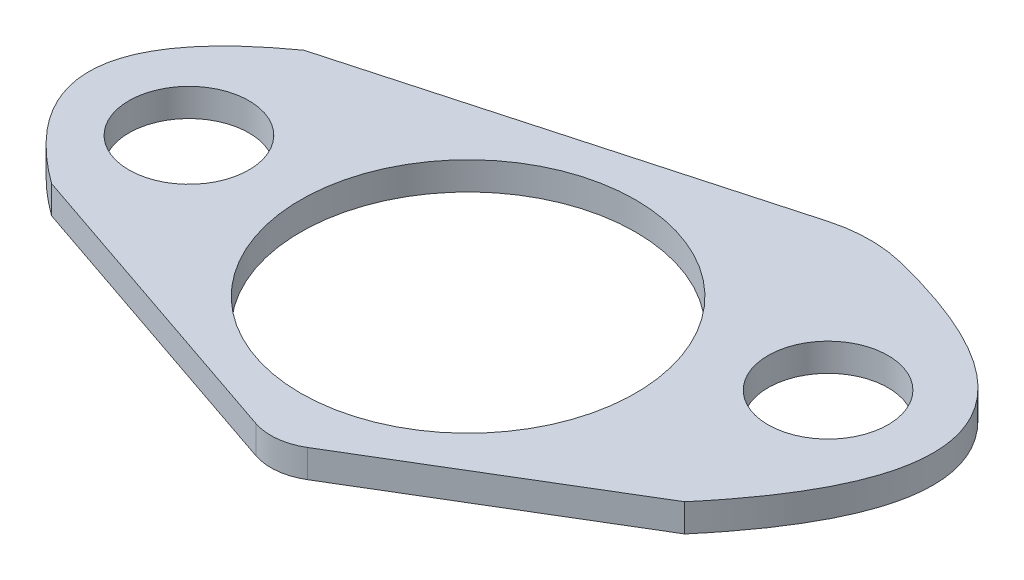
from build123d import *

# Parameters (mm, degrees)
BOSS_EXTRUDE2_DEPTH = 1
SKETCH3_R           = 6
SKETCH3_R_2         = 2.15
CUT_EXTRUDE1_DEPTH  = 1
FILLET1_R           = 2
FILLET4_R           = 5


with BuildPart() as part:
    # Sketch1 → Boss-Extrude2 (new body)
    with BuildSketch(Plane(origin=(0, 0, 0), x_dir=(1, 0, 0), z_dir=(0, 1, 0))):
        with BuildLine():
            Line((-10.579737185, 4.699562588), (5.304686116, 9.105985786))
            add(Edge.make_bspline(
                [(5.304686116, 9.105985786), (17.993455135, 6.637762386), (10.246572083, -2.487952551)],
                knots=[0, 0, 0, 1, 1, 1], degree=2))
            Line((10.246572083, -2.487952551), (1.011646395, -8.037716806))
            Line((1.011646395, -8.037716806), (-10.959675931, -3.958567779))
            add(Edge.make_bspline(
                [(-10.579737185, 4.699562588), (-16.765680179, 0.278506662), (-10.959675931, -3.958567779)],
                knots=[0, 0, 0, 1, 1, 1], degree=2))
        make_face()
    extrude(amount=BOSS_EXTRUDE2_DEPTH)

    # Sketch3 → Cut-Extrude1 (cut)
    with BuildSketch(Plane(origin=(0, 1, 0), x_dir=(1, 0, 0), z_dir=(0, 1, 0))):
        with Locations(Location((0, 0, 0), (0, 0, 270))):
            Circle(SKETCH3_R)
        with Locations(Location((-10, 0, 0), (0, 0, 270))):
            Circle(SKETCH3_R_2)
        with Locations(Location((9.351513774, 3.542483611, 0), (0, 0, 270))):
            Circle(SKETCH3_R_2)
    extrude(amount=-CUT_EXTRUDE1_DEPTH, mode=Mode.SUBTRACT)

    # Fillet1
    fillet1_edges = [part.edges().sort_by_distance(p)[0] for p in [
        (1.011646395, 0.5, 8.037716806),
    ]]
    fillet(fillet1_edges, radius=FILLET1_R)

    # Fillet4
    fillet4_edges = [part.edges().sort_by_distance(p)[0] for p in [
        (5.304686116, 0.5, -9.105985786),
    ]]
    fillet(fillet4_edges, radius=FILLET4_R)


solid = part.part
